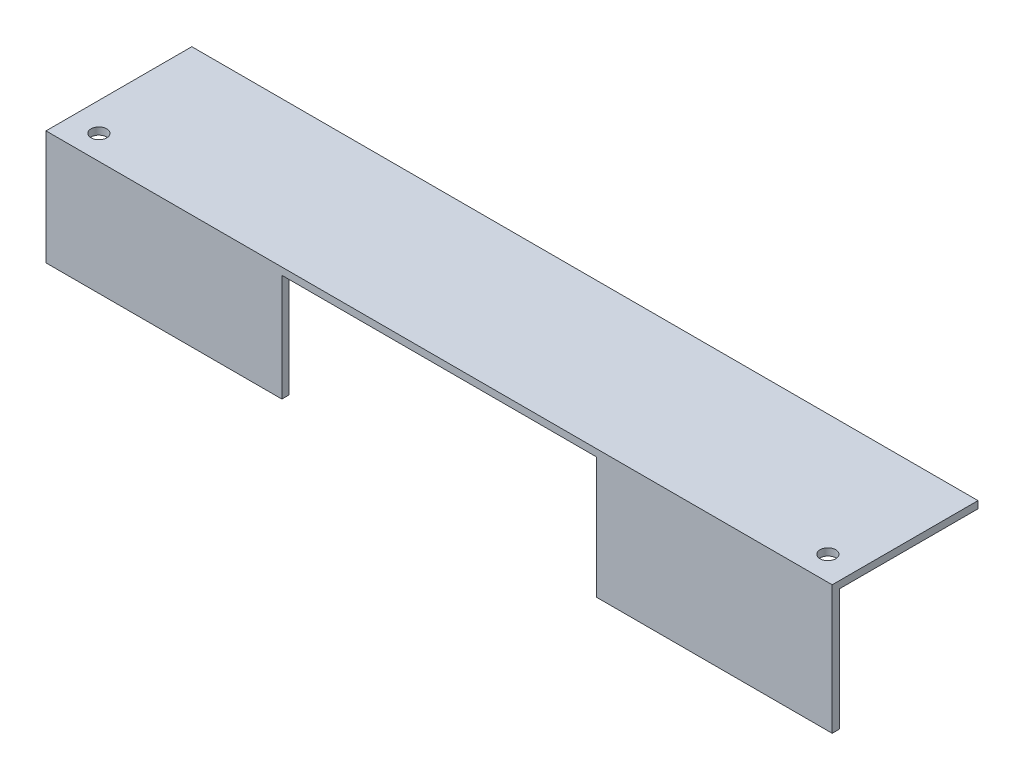
from build123d import *

# Parameters (mm, degrees)
SKETCH_1_W          = 110
SKETCH_1_H          = 19.4
EXTRUDE_1_DEPTH     = 1
SKETCH_2_W          = 33
SKETCH_2_H          = 18
EXTRUDE_2_DEPTH     = 1
SKETCH_3_W          = 33
SKETCH_3_H          = 16
EXTRUDE_3_DEPTH     = 1
SKETCH_5_W          = 44
SKETCH_5_H          = 1
EXTRUDE_5_DEPTH     = 1
SKETCH_6_R          = 1.1
CUT_EXTRUDE_1_DEPTH = 10


with BuildPart() as part:
    # 草图1 → 凸台-拉伸1 (new body)
    with BuildSketch(Plane(origin=(0, 0, 0), x_dir=(1, 0, 0), z_dir=(0, 1, 0))):
        Rectangle(SKETCH_1_W, SKETCH_1_H)
    extrude(amount=EXTRUDE_1_DEPTH)

    # 草图2 → 凸台-拉伸2 (add)
    with BuildSketch(Plane.XY.offset(9.7)):
        with Locations((38.5, -8)):
            Rectangle(SKETCH_2_W, SKETCH_2_H)
    extrude(amount=EXTRUDE_2_DEPTH)

    # 草图3 → 凸台-拉伸3 (add)
    with BuildSketch(Plane.XY.offset(9.7)):
        with Locations((-38.5, -7)):
            Rectangle(SKETCH_3_W, SKETCH_3_H)
    extrude(amount=EXTRUDE_3_DEPTH)

    # 草图5 → 凸台-拉伸5 (add)
    with BuildSketch(Plane(origin=(0, 1, 0), x_dir=(1, 0, 0), z_dir=(0, 1, 0))):
        with Locations((0, -10.2)):
            Rectangle(SKETCH_5_W, SKETCH_5_H)
    extrude(amount=-EXTRUDE_5_DEPTH)

    # 草图6 → 切除-拉伸1 (cut)
    with BuildSketch(Plane(origin=(0, 1, 0), x_dir=(1, 0, 0), z_dir=(0, 1, 0))):
        with Locations(Location((51, -7.3, 0), (0, 0, 270))):
            Circle(SKETCH_6_R)
    cut_extrude_1 = extrude(amount=-CUT_EXTRUDE_1_DEPTH, mode=Mode.SUBTRACT)

    # 镜向1: 切除-拉伸1 across plane
    add(cut_extrude_1.mirror(Plane(origin=(0, 0, 0), x_dir=(0, 0, 1), z_dir=(1, 0, 0))), mode=Mode.SUBTRACT)


solid = part.part
